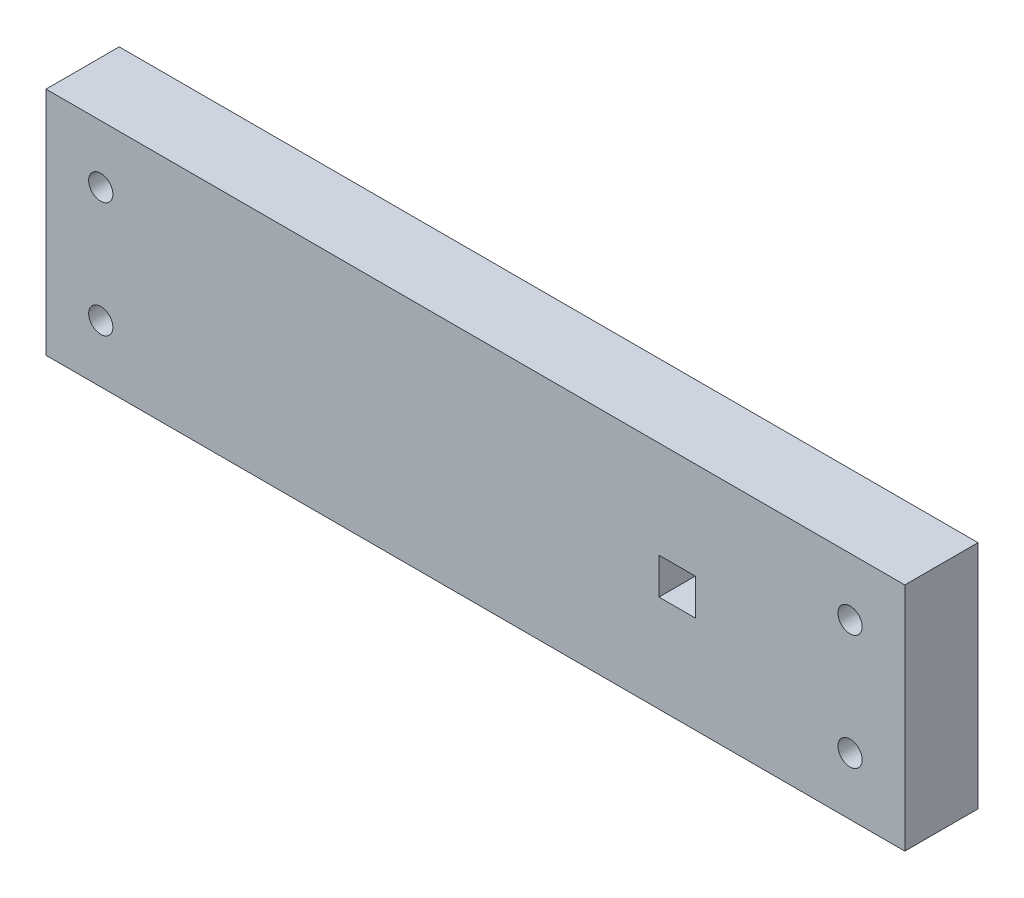
from build123d import *

# Parameters (mm, degrees)
SKETCH1_W                       = 149
SKETCH1_H                       = 40
SKETCH1_W_2                     = 6.3
SKETCH1_H_2                     = 6.3
BOSS_EXTRUDE1_DEPTH             = 12.7
TAP_DRILL_FOR_M5X0_8_TAP2_D     = 4.2
TAP_DRILL_FOR_M5X0_8_TAP2_DEPTH = 7
TAP_DRILL_FOR_M5X0_8_TAP2_TIP   = 1.2618073
TAP_DRILL_FOR_M5X0_8_TAP3_D     = 4.2


with BuildPart() as part:
    # Sketch1 → Boss-Extrude1 (new body)
    with BuildSketch(Plane.XY):
        with Locations((0, 20)):
            Rectangle(SKETCH1_W, SKETCH1_H)
        with Locations((35, 20)):
            Rectangle(SKETCH1_W_2, SKETCH1_H_2, mode=Mode.SUBTRACT)
    extrude(amount=BOSS_EXTRUDE1_DEPTH)

    # Tap Drill for M5x0.8 Tap2
    with Locations(Plane(origin=(-60, 0, 6.35), x_dir=(-1, 0, 0), z_dir=(0, -1, 0))):
        with Locations((0, 0), (-60, 0), (-120, 0)):
            Hole(TAP_DRILL_FOR_M5X0_8_TAP2_D / 2, depth=TAP_DRILL_FOR_M5X0_8_TAP2_DEPTH)
            with Locations((0, 0, -(TAP_DRILL_FOR_M5X0_8_TAP2_DEPTH + TAP_DRILL_FOR_M5X0_8_TAP2_TIP / 2))):  # 118° drill point
                Cone(0, TAP_DRILL_FOR_M5X0_8_TAP2_D / 2, TAP_DRILL_FOR_M5X0_8_TAP2_TIP, mode=Mode.SUBTRACT)

    # Tap Drill for M5x0.8 Tap3 (through all)
    with Locations(Plane.XY.offset(12.7)):
        with Locations((-65, 30), (-65, 10), (65, 10), (65, 30)):
            Hole(TAP_DRILL_FOR_M5X0_8_TAP3_D / 2)


solid = part.part
